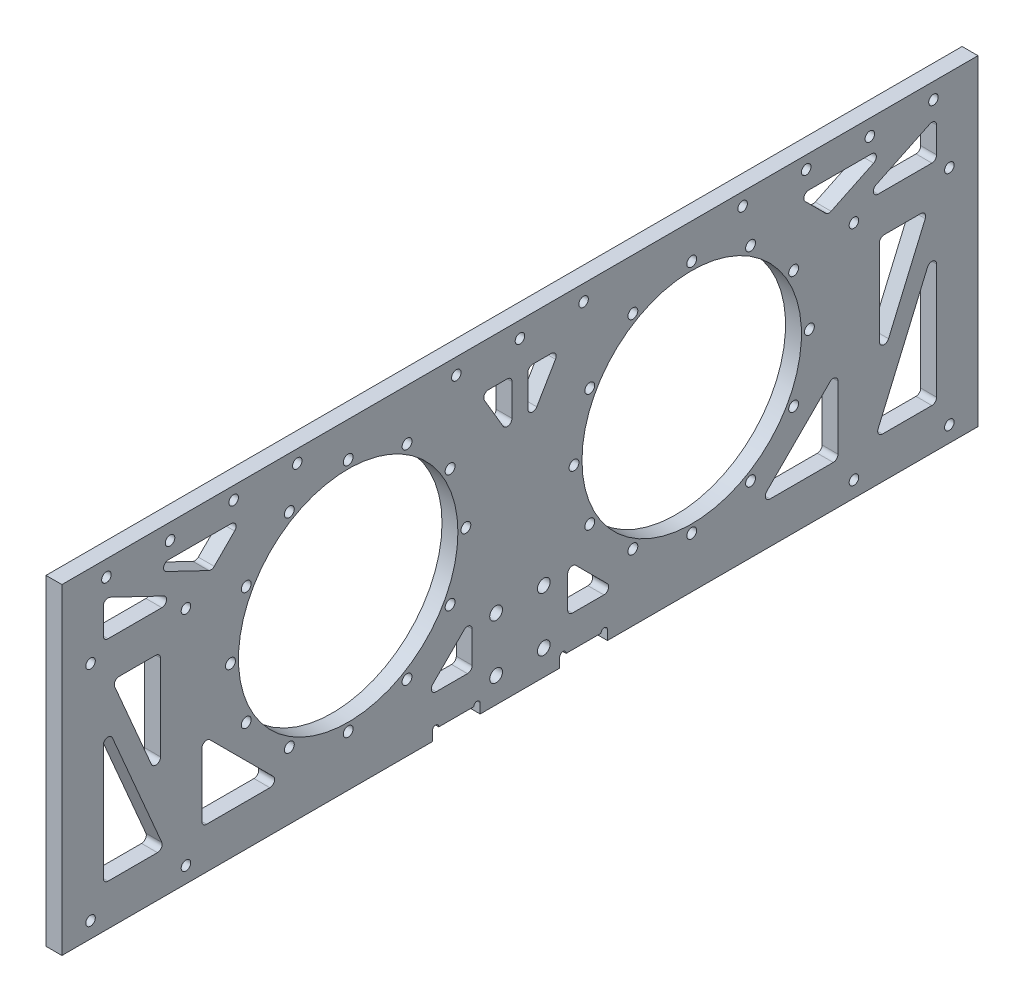
from build123d import *

# Parameters (mm, degrees)
SKETCH_1_W          = 288
SKETCH_1_H          = 101
SKETCH_1_R          = 34.5
SKETCH_1_R_2        = 1.55
SKETCH_1_R_3        = 2
SKETCH_1_R_4        = 1.5
EXTRUDE_1_DEPTH     = 5
SKETCH_2_R          = 1.5
CUT_EXTRUDE_1_DEPTH = 206.031704865
SKETCH_3_R          = 1.5
CUT_EXTRUDE_2_DEPTH = 10
CUT_EXTRUDE_3_DEPTH = 206.031704865
CUT_EXTRUDE_4_DEPTH = 206.031704865


with BuildPart() as part:
    # 草图1 → 凸台-拉伸1 (new body)
    with BuildSketch(Plane(origin=(0, 0, 0), x_dir=(0, 0, -1), z_dir=(1, 0, 0))):
        with Locations((54, -2.5)):
            Rectangle(SKETCH_1_W, SKETCH_1_H)
        Circle(SKETCH_1_R, mode=Mode.SUBTRACT)
        with Locations((0, 37)):
            Circle(SKETCH_1_R_2, mode=Mode.SUBTRACT)
        with Locations((18.5, 32.04293994)):
            Circle(SKETCH_1_R_2, mode=Mode.SUBTRACT)
        with Locations((32.04293994, 18.5)):
            Circle(SKETCH_1_R_2, mode=Mode.SUBTRACT)
        with Locations((37, 0)):
            Circle(SKETCH_1_R_2, mode=Mode.SUBTRACT)
        with Locations((32.04293994, -18.5)):
            Circle(SKETCH_1_R_2, mode=Mode.SUBTRACT)
        with Locations((18.5, -32.04293994)):
            Circle(SKETCH_1_R_2, mode=Mode.SUBTRACT)
        with Locations((0, -37)):
            Circle(SKETCH_1_R_2, mode=Mode.SUBTRACT)
        with Locations((-18.5, -32.04293994)):
            Circle(SKETCH_1_R_2, mode=Mode.SUBTRACT)
        with Locations((-32.04293994, -18.5)):
            Circle(SKETCH_1_R_2, mode=Mode.SUBTRACT)
        with Locations((-37, 0)):
            Circle(SKETCH_1_R_2, mode=Mode.SUBTRACT)
        with Locations((-32.04293994, 18.5)):
            Circle(SKETCH_1_R_2, mode=Mode.SUBTRACT)
        with Locations((-18.5, 32.04293994)):
            Circle(SKETCH_1_R_2, mode=Mode.SUBTRACT)
        with Locations(Location((126.5, 32.04293994, 0), (0, 0, 180))):
            Circle(SKETCH_1_R_2, mode=Mode.SUBTRACT)
        with Locations(Location((140.04293994, 18.5, 0), (0, 0, 180))):
            Circle(SKETCH_1_R_2, mode=Mode.SUBTRACT)
        with Locations(Location((145, 0, 0), (0, 0, 180))):
            Circle(SKETCH_1_R_2, mode=Mode.SUBTRACT)
        with Locations(Location((140.04293994, -18.5, 0), (0, 0, 180))):
            Circle(SKETCH_1_R_2, mode=Mode.SUBTRACT)
        with Locations(Location((126.5, -32.04293994, 0), (0, 0, 180))):
            Circle(SKETCH_1_R_2, mode=Mode.SUBTRACT)
        with Locations(Location((108, -37, 0), (0, 0, 180))):
            Circle(SKETCH_1_R_2, mode=Mode.SUBTRACT)
        with Locations(Location((89.5, -32.04293994, 0), (0, 0, 180))):
            Circle(SKETCH_1_R_2, mode=Mode.SUBTRACT)
        with Locations(Location((75.95706006, -18.5, 0), (0, 0, 180))):
            Circle(SKETCH_1_R_2, mode=Mode.SUBTRACT)
        with Locations(Location((71, 0, 0), (0, 0, 180))):
            Circle(SKETCH_1_R_2, mode=Mode.SUBTRACT)
        with Locations(Location((75.95706006, 18.5, 0), (0, 0, 180))):
            Circle(SKETCH_1_R_2, mode=Mode.SUBTRACT)
        with Locations(Location((89.5, 32.04293994, 0), (0, 0, 180))):
            Circle(SKETCH_1_R_2, mode=Mode.SUBTRACT)
        with Locations(Location((108, 37, 0), (0, 0, 180))):
            Circle(SKETCH_1_R_2, mode=Mode.SUBTRACT)
        with Locations(Location((108, 0, 0), (0, 0, 180))):
            Circle(SKETCH_1_R, mode=Mode.SUBTRACT)
        with Locations((61.5, -28)):
            Circle(SKETCH_1_R_3, mode=Mode.SUBTRACT)
        with Locations((46.5, -28)):
            Circle(SKETCH_1_R_3, mode=Mode.SUBTRACT)
        with Locations((46.5, -45)):
            Circle(SKETCH_1_R_3, mode=Mode.SUBTRACT)
        with Locations((61.5, -45)):
            Circle(SKETCH_1_R_3, mode=Mode.SUBTRACT)
        with Locations((-16, 44)):
            Circle(SKETCH_1_R_4, mode=Mode.SUBTRACT)
        with Locations((-36, 44)):
            Circle(SKETCH_1_R_4, mode=Mode.SUBTRACT)
        with Locations(Location((124, 44, 0), (0, 0, 180))):
            Circle(SKETCH_1_R_4, mode=Mode.SUBTRACT)
        with Locations(Location((144, 44, 0), (0, 0, 180))):
            Circle(SKETCH_1_R_4, mode=Mode.SUBTRACT)
    extrude(amount=EXTRUDE_1_DEPTH)

    # 草图2 → 切除-拉伸1 (cut, through all)
    with BuildSketch(Plane(origin=(5, 0, 0), x_dir=(0, 0, -1), z_dir=(1, 0, 0))):
        with Locations((-76, 43)):
            Circle(SKETCH_2_R)
        with Locations((-56, 43)):
            Circle(SKETCH_2_R)
        with Locations(Location((164, 43, 0), (0, 0, 180))):
            Circle(SKETCH_2_R)
        with Locations(Location((184, 43, 0), (0, 0, 180))):
            Circle(SKETCH_2_R)
        with Locations((34, 43)):
            Circle(SKETCH_2_R)
        with Locations((54, 43)):
            Circle(SKETCH_2_R)
        with Locations(Location((74, 43, 0), (0, 0, 180))):
            Circle(SKETCH_2_R)
    extrude(amount=-CUT_EXTRUDE_1_DEPTH, mode=Mode.SUBTRACT)

    # 草图3 → 切除-拉伸2 (cut)
    with BuildSketch(Plane(origin=(5, 0, 0), x_dir=(0, 0, -1), z_dir=(1, 0, 0))):
        with Locations((-81, -48)):
            Circle(SKETCH_3_R)
        with Locations((-51, -48)):
            Circle(SKETCH_3_R)
        with Locations((-81, 22)):
            Circle(SKETCH_3_R)
        with Locations((-51, 22)):
            Circle(SKETCH_3_R)
        with Locations(Location((159, 22, 0), (0, 0, 180))):
            Circle(SKETCH_3_R)
        with Locations(Location((189, 22, 0), (0, 0, 180))):
            Circle(SKETCH_3_R)
        with Locations(Location((159, -48, 0), (0, 0, 180))):
            Circle(SKETCH_3_R)
        with Locations(Location((189, -48, 0), (0, 0, 180))):
            Circle(SKETCH_3_R)
    extrude(amount=-CUT_EXTRUDE_2_DEPTH, mode=Mode.SUBTRACT)

    # 草图4 → 切除-拉伸3 (cut, through all)
    with BuildSketch(Plane(origin=(5, 0, 0), x_dir=(0, 0, -1), z_dir=(1, 0, 0))):
        with BuildLine():
            Line((44.122624964, 34), (50, 34))
            ThreePointArc((50, 34), (51.060660172, 33.560660172), (51.5, 32.5))
            Line((51.5, 32.5), (51.5, 22.508462438))
            ThreePointArc((51.5, 22.508462438), (50.394111669, 21.061162887), (48.707098677, 21.747932249))
            Line((48.707098677, 21.747932249), (42.829723641, 31.73946981))
            ThreePointArc((42.829723641, 31.73946981), (42.820550603, 33.244716293), (44.122624964, 34))
        make_face()
        with BuildLine():
            Line((56.5, 32.5), (56.5, 22.508462438))
            ThreePointArc((56.5, 22.508462438), (57.605888331, 21.061162887), (59.292901323, 21.747932249))
            Line((59.292901323, 21.747932249), (65.170276359, 31.73946981))
            ThreePointArc((65.170276359, 31.73946981), (65.179449397, 33.244716293), (63.877375036, 34))
            Line((63.877375036, 34), (58, 34))
            ThreePointArc((58, 34), (56.939339828, 33.560660172), (56.5, 32.5))
        make_face()
        with BuildLine():
            Line((-77, -2.256992992), (-77, -38.5))
            ThreePointArc((-77, -38.5), (-76.560660172, -39.560660172), (-75.5, -40))
            Line((-75.5, -40), (-59.967282711, -40))
            ThreePointArc((-59.967282711, -40), (-58.715021073, -39.325736513), (-58.588565166, -37.909121052))
            Line((-58.588565166, -37.909121052), (-74.121282455, -1.666114044))
            ThreePointArc((-74.121282455, -1.666114044), (-75.801598808, -0.787626408), (-77, -2.256992992))
        make_face()
        with BuildLine():
            Line((-72.032717289, 14), (-60.5, 14))
            ThreePointArc((-60.5, 14), (-59.439339828, 13.560660172), (-59, 12.5))
            Line((-59, 12.5), (-59, -14.409673675))
            ThreePointArc((-59, -14.409673675), (-60.198401192, -15.879040259), (-61.878717545, -15.000552622))
            Line((-61.878717545, -15.000552622), (-73.411434834, 11.909121052))
            ThreePointArc((-73.411434834, 11.909121052), (-73.284978927, 13.325736513), (-72.032717289, 14))
        make_face()
        with BuildLine():
            Line((-46, -18.621320344), (-46, -38.5))
            ThreePointArc((-46, -38.5), (-45.560660172, -39.560660172), (-44.5, -40))
            Line((-44.5, -40), (-24.621320344, -40))
            ThreePointArc((-24.621320344, -40), (-23.235501045, -39.074025149), (-23.560660172, -37.439339828))
            Line((-23.560660172, -37.439339828), (-43.439339828, -17.560660172))
            ThreePointArc((-43.439339828, -17.560660172), (-45.074025149, -17.235501045), (-46, -18.621320344))
        make_face()
        with BuildLine():
            Line((-77, 35.616149045), (-77, 27.5))
            ThreePointArc((-77, 27.5), (-76.560660172, 26.439339828), (-75.5, 26))
            Line((-75.5, 26), (-58.591356156, 26))
            ThreePointArc((-58.591356156, 26), (-57.128751138, 27.167153849), (-57.942259555, 28.852284586))
            Line((-57.942259555, 28.852284586), (-74.850903399, 36.968433631))
            ThreePointArc((-74.850903399, 36.968433631), (-76.298860156, 36.885724742), (-77, 35.616149045))
        make_face()
        with BuildLine():
            Line((-56.54321922, 38), (-36.75589572, 38))
            ThreePointArc((-36.75589572, 38), (-35.370076421, 37.074025149), (-35.695235548, 35.439339828))
            Line((-35.695235548, 35.439339828), (-42.112745872, 29.021829504))
            ThreePointArc((-42.112745872, 29.021829504), (-42.921201082, 28.603844127), (-43.822502646, 28.730205089))
            Line((-43.822502646, 28.730205089), (-57.192315822, 35.147715414))
            ThreePointArc((-57.192315822, 35.147715414), (-58.005824239, 36.832846151), (-56.54321922, 38))
        make_face()
        with BuildLine():
            Line((27.621320344, -40), (37.5, -40))
            ThreePointArc((37.5, -40), (38.560660172, -39.560660172), (39, -38.5))
            Line((39, -38.5), (39, -28.621320344))
            ThreePointArc((39, -28.621320344), (38.074025149, -27.235501045), (36.439339828, -27.560660172))
            Line((36.439339828, -27.560660172), (26.560660172, -37.439339828))
            ThreePointArc((26.560660172, -37.439339828), (26.235501045, -39.074025149), (27.621320344, -40))
        make_face()
        with BuildLine():
            Line((71.560660172, -27.560660172), (81.439339828, -37.439339828))
            ThreePointArc((81.439339828, -37.439339828), (81.764498955, -39.074025149), (80.378679656, -40))
            Line((80.378679656, -40), (70.5, -40))
            ThreePointArc((70.5, -40), (69.439339828, -39.560660172), (69, -38.5))
            Line((69, -38.5), (69, -28.621320344))
            ThreePointArc((69, -28.621320344), (69.925974851, -27.235501045), (71.560660172, -27.560660172))
        make_face()
        with BuildLine():
            Line((151.822502646, 28.730205089), (165.192315822, 35.147715414))
            ThreePointArc((165.192315822, 35.147715414), (166.005824239, 36.832846151), (164.54321922, 38))
            Line((164.54321922, 38), (144.75589572, 38))
            ThreePointArc((144.75589572, 38), (143.370076421, 37.074025149), (143.695235548, 35.439339828))
            Line((143.695235548, 35.439339828), (150.112745872, 29.021829504))
            ThreePointArc((150.112745872, 29.021829504), (150.921201082, 28.603844127), (151.822502646, 28.730205089))
        make_face()
        with BuildLine():
            Line((165.942259555, 28.852284586), (182.850903399, 36.968433631))
            ThreePointArc((182.850903399, 36.968433631), (184.298860156, 36.885724742), (185, 35.616149045))
            Line((185, 35.616149045), (185, 27.5))
            ThreePointArc((185, 27.5), (184.560660172, 26.439339828), (183.5, 26))
            Line((183.5, 26), (166.591356156, 26))
            ThreePointArc((166.591356156, 26), (165.128751138, 27.167153849), (165.942259555, 28.852284586))
        make_face()
        with BuildLine():
            Line((131.560660172, -37.439339828), (151.439339828, -17.560660172))
            ThreePointArc((151.439339828, -17.560660172), (153.074025149, -17.235501045), (154, -18.621320344))
            Line((154, -18.621320344), (154, -38.5))
            ThreePointArc((154, -38.5), (153.560660172, -39.560660172), (152.5, -40))
            Line((152.5, -40), (132.621320344, -40))
            ThreePointArc((132.621320344, -40), (131.235501045, -39.074025149), (131.560660172, -37.439339828))
        make_face()
        with BuildLine():
            Line((169.878717545, -15.000552622), (181.411434834, 11.909121052))
            ThreePointArc((181.411434834, 11.909121052), (181.284978927, 13.325736513), (180.032717289, 14))
            Line((180.032717289, 14), (168.5, 14))
            ThreePointArc((168.5, 14), (167.439339828, 13.560660172), (167, 12.5))
            Line((167, 12.5), (167, -14.409673675))
            ThreePointArc((167, -14.409673675), (168.198401192, -15.879040259), (169.878717545, -15.000552622))
        make_face()
        with BuildLine():
            Line((166.588565166, -37.909121052), (182.121282455, -1.666114044))
            ThreePointArc((182.121282455, -1.666114044), (183.801598808, -0.787626408), (185, -2.256992992))
            Line((185, -2.256992992), (185, -38.5))
            ThreePointArc((185, -38.5), (184.560660172, -39.560660172), (183.5, -40))
            Line((183.5, -40), (167.967282711, -40))
            ThreePointArc((167.967282711, -40), (166.715021073, -39.325736513), (166.588565166, -37.909121052))
        make_face()
    extrude(amount=-CUT_EXTRUDE_3_DEPTH, mode=Mode.SUBTRACT)

    # 草图6 → 切除-拉伸4 (cut, through all)
    with BuildSketch(Plane(origin=(5, 0, 0), x_dir=(0, 0, -1), z_dir=(1, 0, 0))):
        with BuildLine():
            Line((41.5, -53), (41.5, -50))
            ThreePointArc((41.5, -50), (40.5, -49), (39.5, -50))
            Line((39.5, -50), (28.5, -50))
            ThreePointArc((28.5, -50), (27.5, -49), (26.5, -50))
            Line((26.5, -50), (26.5, -53))
            Line((26.5, -53), (41.5, -53))
        make_face()
        with BuildLine():
            Line((81.5, -53), (66.5, -53))
            Line((66.5, -53), (66.5, -50))
            ThreePointArc((66.5, -50), (67.5, -49), (68.5, -50))
            Line((68.5, -50), (79.5, -50))
            ThreePointArc((79.5, -50), (80.5, -49), (81.5, -50))
            Line((81.5, -50), (81.5, -53))
        make_face()
    extrude(amount=-CUT_EXTRUDE_4_DEPTH, mode=Mode.SUBTRACT)


solid = part.part
